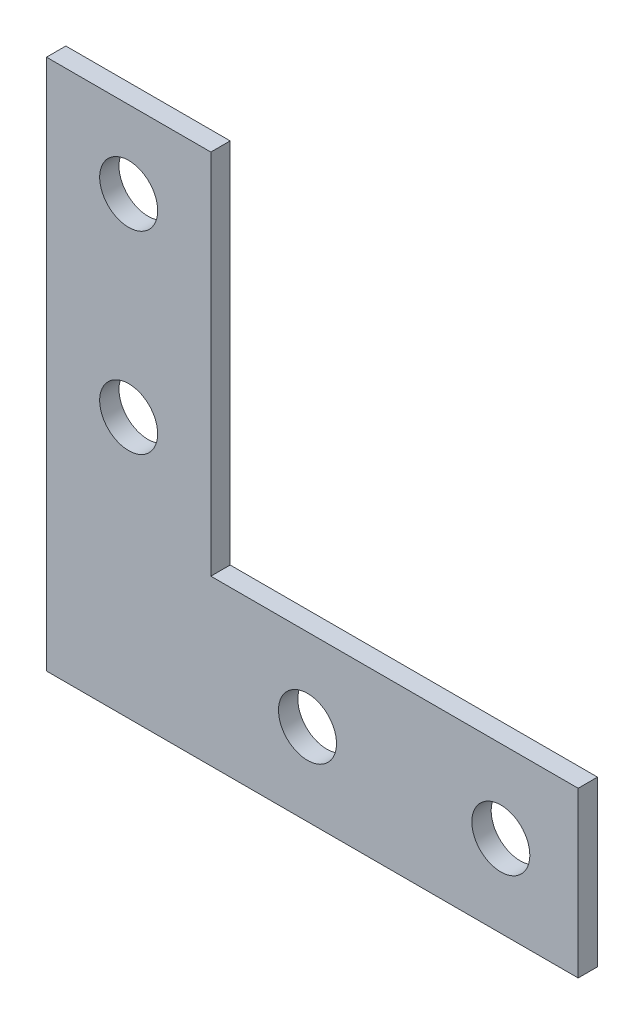
from build123d import *

# Parameters (mm, degrees)
SKETCH_1_W          = 17
SKETCH_1_H          = 55
EXTRUDE_1_DEPTH     = 2
SKETCH_2_R          = 3
CUT_EXTRUDE_1_DEPTH = 10


with BuildPart() as part:
    # 草图1 → 凸台-拉伸1 (new body)
    with BuildSketch(Plane.XY):
        Rectangle(SKETCH_1_W, SKETCH_1_H)
    extrude_1 = extrude(amount=EXTRUDE_1_DEPTH)

    # 镜向1: 凸台-拉伸1 across plane
    add(extrude_1.mirror(Plane(origin=(9.5, -9.5, 0), x_dir=(0, 0, 1), z_dir=(0.7071067811865488, -0.7071067811865464, 0))))

    # 草图2 → 切除-拉伸1 (cut)
    with BuildSketch(Plane.XY.offset(2)):
        with Locations((0, 19.5)):
            Circle(SKETCH_2_R)
        with Locations((0, -0.5)):
            Circle(SKETCH_2_R)
    cut_extrude_1 = extrude(amount=-CUT_EXTRUDE_1_DEPTH, mode=Mode.SUBTRACT)

    # 镜向2: 切除-拉伸1 across plane
    add(cut_extrude_1.mirror(Plane(origin=(9.5, -9.5, 0), x_dir=(0, 0, 1), z_dir=(0.7071067811865479, -0.7071067811865471, 0))), mode=Mode.SUBTRACT)


solid = part.part
